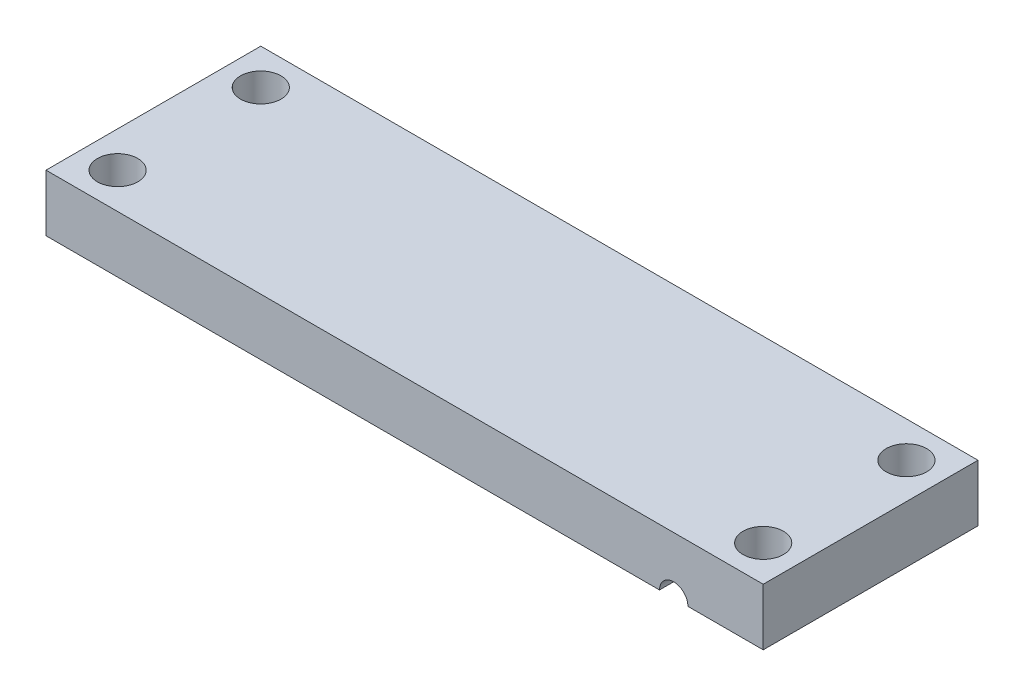
from build123d import *

# Parameters (mm, degrees)
SKETCH1_W           = 40.07
SKETCH1_H           = 12
SKETCH1_R           = 1.1303
BOSS_EXTRUDE1_DEPTH = 3.175
SKETCH3_R           = 0.79375
SKETCH5_R           = 0.79375
SKETCH8_R           = 0.79375


with BuildPart() as part:
    # Sketch1 → Boss-Extrude1 (new body)
    with BuildSketch(Plane(origin=(0, 0, 0), x_dir=(1, 0, 0), z_dir=(0, 1, 0))):
        with Locations((20.035, -6)):
            Rectangle(SKETCH1_W, SKETCH1_H)
        with Locations(Location((2, -2, 0), (0, 0, 270))):
            Circle(SKETCH1_R, mode=Mode.SUBTRACT)
        with Locations(Location((38.07, -2, 0), (0, 0, 270))):
            Circle(SKETCH1_R, mode=Mode.SUBTRACT)
        with Locations(Location((38.07, -10, 0), (0, 0, 270))):
            Circle(SKETCH1_R, mode=Mode.SUBTRACT)
        with Locations(Location((2, -10, 0), (0, 0, 270))):
            Circle(SKETCH1_R, mode=Mode.SUBTRACT)
    extrude(amount=BOSS_EXTRUDE1_DEPTH)

    # Cut-Sweep5: sweep along a path in Sketch2
    with BuildLine(Plane(origin=(0, 0, 0), x_dir=(1, 0, 0), z_dir=(0, 1, 0))) as cut_sweep5_path:
        Line((5, 0), (5, -8.4))
        ThreePointArc((5, -8.4), (6.5875, -9.9875), (8.175, -8.4))
        Line((8.175, -8.4), (8.175, -4.9))
        ThreePointArc((8.175, -4.9), (9.7625, -3.3125), (11.35, -4.9))
        Line((11.35, -4.9), (11.35, -8.4))
        ThreePointArc((11.35, -8.4), (12.9375, -9.9875), (14.525, -8.4))
        Line((14.525, -8.4), (14.525, -4.9))
        ThreePointArc((14.525, -4.9), (14.989967985, -3.777467985), (16.1125, -3.3125))
        Line((16.1125, -3.3125), (17.072341776, -3.3125))
        Line((17.072341776, -3.3125), (22.997658224, -8.6875))
        Line((22.997658224, -8.6875), (23.9575, -8.6875))
        ThreePointArc((23.9575, -8.6875), (25.080032015, -8.222532015), (25.545, -7.1))
        Line((25.545, -7.1), (25.545, -3.6))
        ThreePointArc((25.545, -3.6), (27.1325, -2.0125), (28.72, -3.6))
        Line((28.72, -3.6), (28.72, -7.1))
        ThreePointArc((28.72, -7.1), (30.3075, -8.6875), (31.895, -7.1))
        Line((31.895, -7.1), (31.895, -3.6))
        ThreePointArc((31.895, -3.6), (33.4825, -2.0125), (35.07, -3.6))
        Line((35.07, -3.6), (35.07, -12))
    # Sketch3 → Cut-Sweep5 (sweep, cut)
    with BuildSketch(Plane(origin=(0, 0, 0), x_dir=(-1, 0, 0), z_dir=(0, 0, -1))):
        with Locations((-5, 0)):
            Circle(SKETCH3_R)
    sweep(path=cut_sweep5_path.line, transition=Transition.RIGHT, mode=Mode.SUBTRACT)

    # Cut-Sweep10: sweep along a path in Sketch6
    with BuildLine(Plane(origin=(0, 0, 0), x_dir=(-1, 0, 0), z_dir=(0, -1, 0))) as cut_sweep10_path:
        Line((-38.07, -6), (-35.07, -3.6))
        Line((-35.07, -3.6), (-35.07, -12))
    # Sketch5 → Cut-Sweep10 (sweep, cut)
    with BuildSketch(Plane.XY.offset(12)):
        with Locations((35.07, 0)):
            Circle(SKETCH5_R)
    sweep(path=cut_sweep10_path.line, transition=Transition.RIGHT, mode=Mode.SUBTRACT)

    # Cut-Sweep11: sweep along a path in Sketch9
    with BuildLine(Plane.XZ) as cut_sweep11_path:
        Line((5, 0), (5, 8.4))
        Line((5, 8.4), (2, 6))
    # Sketch8 → Cut-Sweep11 (sweep, cut)
    with BuildSketch(Plane(origin=(0, 0, 0), x_dir=(-1, 0, 0), z_dir=(0, 0, -1))):
        with Locations((-5, 0)):
            Circle(SKETCH8_R)
    sweep(path=cut_sweep11_path.line, transition=Transition.RIGHT, mode=Mode.SUBTRACT)


solid = part.part
